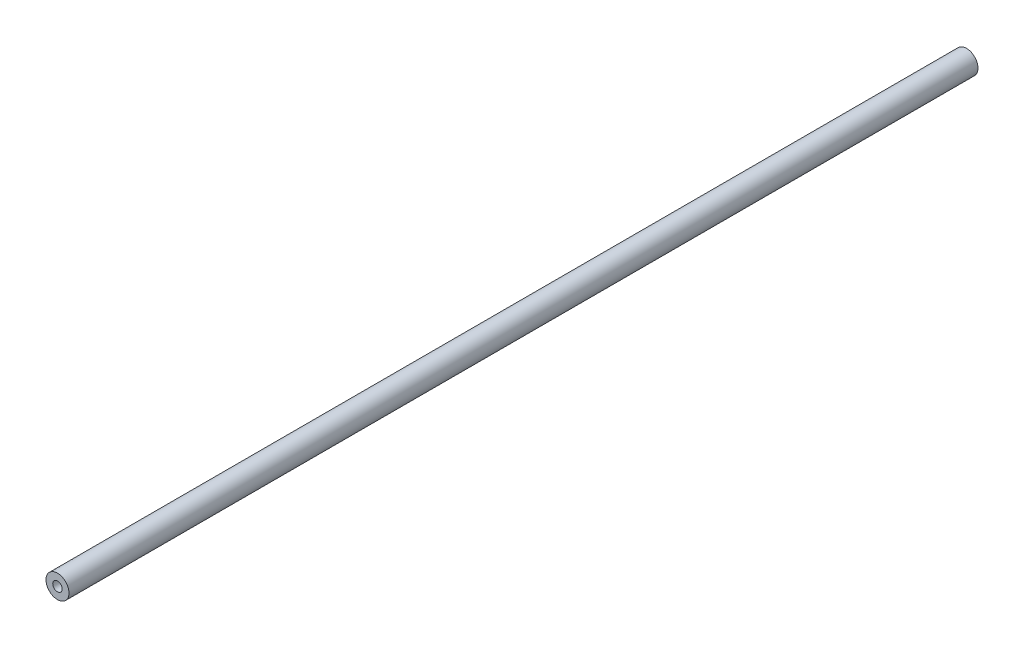
from build123d import *

# Parameters (mm, degrees)
SKETCH_1_R      = 4
EXTRUDE_1_DEPTH = 158
M4X0_72_D       = 3.3
M4X0_72_DEPTH   = 19
M4X0_72_TIP     = 0.991420021
M4X0_71_D       = 3.3
M4X0_71_DEPTH   = 19
M4X0_71_TIP     = 0.991420021


with BuildPart() as part:
    # Эскиз1 → Бобышка-Вытянуть1 (new, symmetric)
    with BuildSketch(Plane.XY):
        Circle(SKETCH_1_R)
    extrude(amount=EXTRUDE_1_DEPTH, both=True)

    # Отверстие обработанное метчиком M4x0.72
    with Locations(Plane(origin=(0, 0, -158), x_dir=(-1, 0, 0), z_dir=(0, 0, -1))):
        with Locations((0, 0)):
            Hole(M4X0_72_D / 2, depth=M4X0_72_DEPTH)
            with Locations((0, 0, -(M4X0_72_DEPTH + M4X0_72_TIP / 2))):  # 118° drill point
                Cone(0, M4X0_72_D / 2, M4X0_72_TIP, mode=Mode.SUBTRACT)

    # Отверстие обработанное метчиком M4x0.71
    with Locations(Plane.XY.offset(158)):
        with Locations((0, 0)):
            Hole(M4X0_71_D / 2, depth=M4X0_71_DEPTH)
            with Locations((0, 0, -(M4X0_71_DEPTH + M4X0_71_TIP / 2))):  # 118° drill point
                Cone(0, M4X0_71_D / 2, M4X0_71_TIP, mode=Mode.SUBTRACT)


solid = part.part
